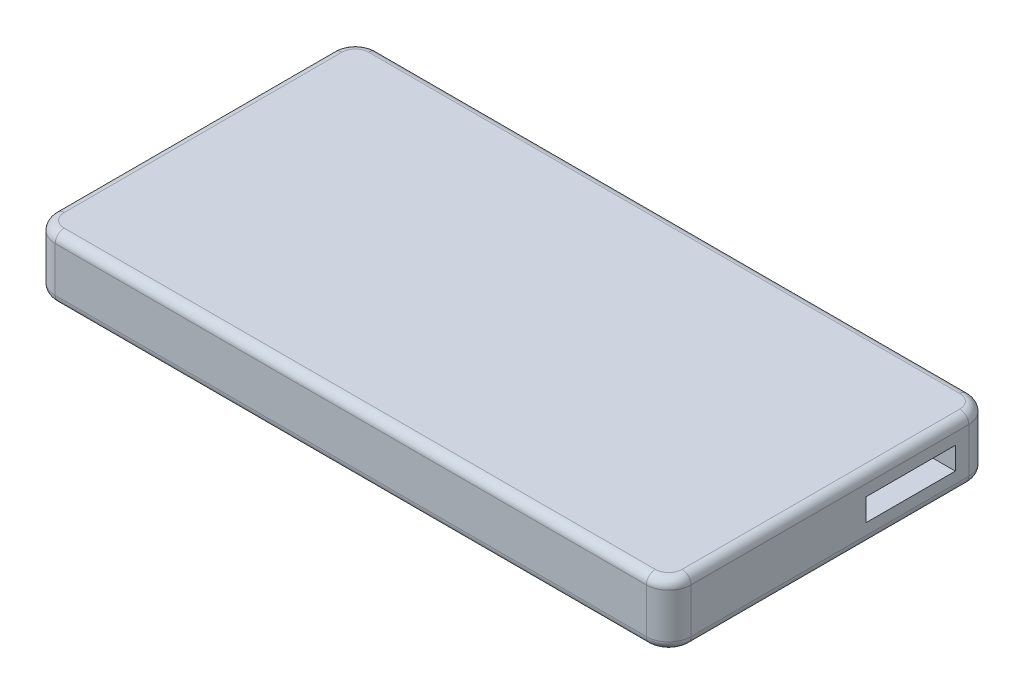
from build123d import *

# Parameters (mm, degrees)
BOSS_EXTRUDE1_DEPTH = 14
FILLET1_R           = 2
SKETCH2_W           = 20
SKETCH2_H           = 5
CUT_EXTRUDE1_DEPTH  = 20


with BuildPart() as part:
    # Sketch1 → Boss-Extrude1 (new body)
    with BuildSketch(Plane(origin=(0, -5, 0), x_dir=(1, 0, 0), z_dir=(0, 1, 0))):
        with BuildLine():
            Line((-111.451663584, 33.777598009), (20.548336416, 33.777598009))
            ThreePointArc((20.548336416, 33.777598009), (24.083870322, 35.242064103), (25.548336416, 38.777598009))
            Line((25.548336416, 38.777598009), (25.548336416, 100.777598009))
            ThreePointArc((25.548336416, 100.777598009), (24.083870322, 104.313131915), (20.548336416, 105.777598009))
            Line((20.548336416, 105.777598009), (-111.451663584, 105.777598009))
            ThreePointArc((-111.451663584, 105.777598009), (-114.98719749, 104.313131915), (-116.451663584, 100.777598009))
            Line((-116.451663584, 100.777598009), (-116.451663584, 38.777598009))
            ThreePointArc((-116.451663584, 38.777598009), (-114.98719749, 35.242064103), (-111.451663584, 33.777598009))
        make_face()
    extrude(amount=BOSS_EXTRUDE1_DEPTH)

    # Fillet1
    fillet1_edges = [part.edges().sort_by_distance(p)[0] for p in [
        (-114.98719749, 9, -35.242064103),
        (-116.451663584, -5, -69.777598009),
        (-114.98719749, -5, -104.313131915),
        (-45.451663584, 9, -33.777598009),
        (24.083870322, 9, -35.242064103),
        (25.548336416, 9, -69.777598009),
        (24.083870322, 9, -104.313131915),
        (-45.451663584, 9, -105.777598009),
        (-114.98719749, 9, -104.313131915),
        (-116.451663584, 9, -69.777598009),
        (-45.451663584, -5, -105.777598009),
        (24.083870322, -5, -104.313131915),
        (25.548336416, -5, -69.777598009),
        (24.083870322, -5, -35.242064103),
        (-45.451663584, -5, -33.777598009),
        (-114.98719749, -5, -35.242064103),
    ]]
    fillet(fillet1_edges, radius=FILLET1_R)

    # Sketch2 → Cut-Extrude1 (cut)
    with BuildSketch(Plane(origin=(25.548336416, 0, 0), x_dir=(0, 0, -1), z_dir=(1, 0, 0))):
        with Locations((87.777598009, 2)):
            Rectangle(SKETCH2_W, SKETCH2_H)
    extrude(amount=-CUT_EXTRUDE1_DEPTH, mode=Mode.SUBTRACT)


solid = part.part
